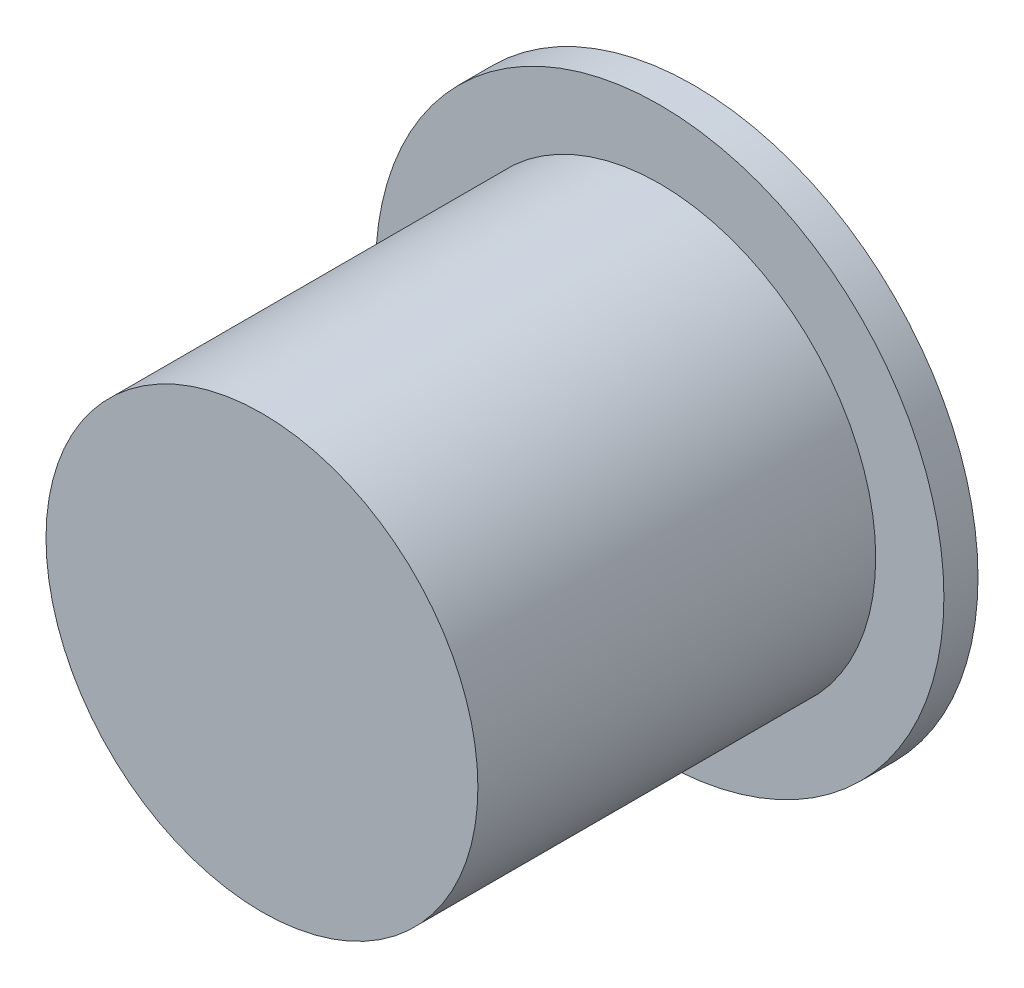
from build123d import *

# Parameters (mm, degrees)
ESQUISSE1_R             = 19
BASE_EXTRUSION_DEPTH    = 35
ESQUISSE2_R             = 25
BOSS_EXTRU_1_DEPTH      = 3
ESQUISSE3_R             = 10
BOSS_EXTRU_2_DEPTH      = 2
ESQUISSE4_R             = 2.5
ENL_V_MAT_EXTRU_1_DEPTH = 10


with BuildPart() as part:
    # Esquisse1 → Base-Extrusion (new body)
    with BuildSketch(Plane.XY):
        Circle(ESQUISSE1_R)
    extrude(amount=BASE_EXTRUSION_DEPTH)

    # Esquisse2 → Boss.-Extru.1 (add)
    with BuildSketch(Plane(origin=(0, 0, 0), x_dir=(-1, 0, 0), z_dir=(0, 0, -1))):
        Circle(ESQUISSE2_R)
    extrude(amount=BOSS_EXTRU_1_DEPTH)

    # Esquisse3 → Boss.-Extru.2 (add)
    with BuildSketch(Plane(origin=(0, 0, -3), x_dir=(-1, 0, 0), z_dir=(0, 0, -1))):
        Circle(ESQUISSE3_R)
    extrude(amount=BOSS_EXTRU_2_DEPTH)

    # Esquisse4 → Enlèv. mat.-Extru.1 (cut)
    with BuildSketch(Plane(origin=(0, 0, -5), x_dir=(-1, 0, 0), z_dir=(0, 0, -1))):
        Circle(ESQUISSE4_R)
    extrude(amount=-ENL_V_MAT_EXTRU_1_DEPTH, mode=Mode.SUBTRACT)


solid = part.part
